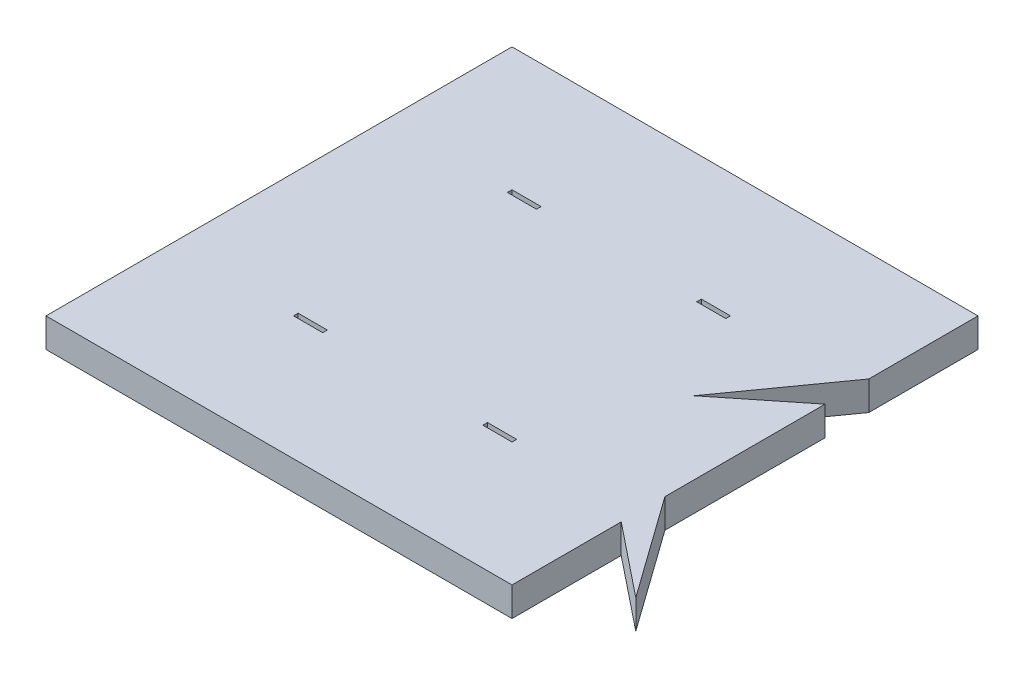
from build123d import *

# Parameters (mm, degrees)
BOSS_EXTRUDE1_DEPTH = 20
SKETCH2_W           = 20
SKETCH2_H           = 3.175
CUT_EXTRUDE2_DEPTH  = 490.591666596


with BuildPart() as part:
    # Sketch1 → Boss-Extrude1 (new body)
    with BuildSketch(Plane(origin=(0, 0, 0), x_dir=(1, 0, 0), z_dir=(0, 1, 0))):
        Polygon((320, 245), (270, 175), (320, 215), (320, 105), (370, 35), (320, 75), (320, 0), (0, 0), (0, 320), (320, 320), align=None)
    extrude(amount=BOSS_EXTRUDE1_DEPTH)

    # Sketch2 → Cut-Extrude2 (cut, through all)
    with BuildSketch(Plane(origin=(0, 20, 0), x_dir=(1, 0, 0), z_dir=(0, 1, 0))):
        with Locations((225, 233.4125)):
            Rectangle(SKETCH2_W, SKETCH2_H)
        with Locations((95, 233.4125)):
            Rectangle(SKETCH2_W, SKETCH2_H)
        with Locations((95, 86.5875)):
            Rectangle(SKETCH2_W, SKETCH2_H)
        with Locations((225, 86.5875)):
            Rectangle(SKETCH2_W, SKETCH2_H)
    extrude(amount=-CUT_EXTRUDE2_DEPTH, mode=Mode.SUBTRACT)


solid = part.part
